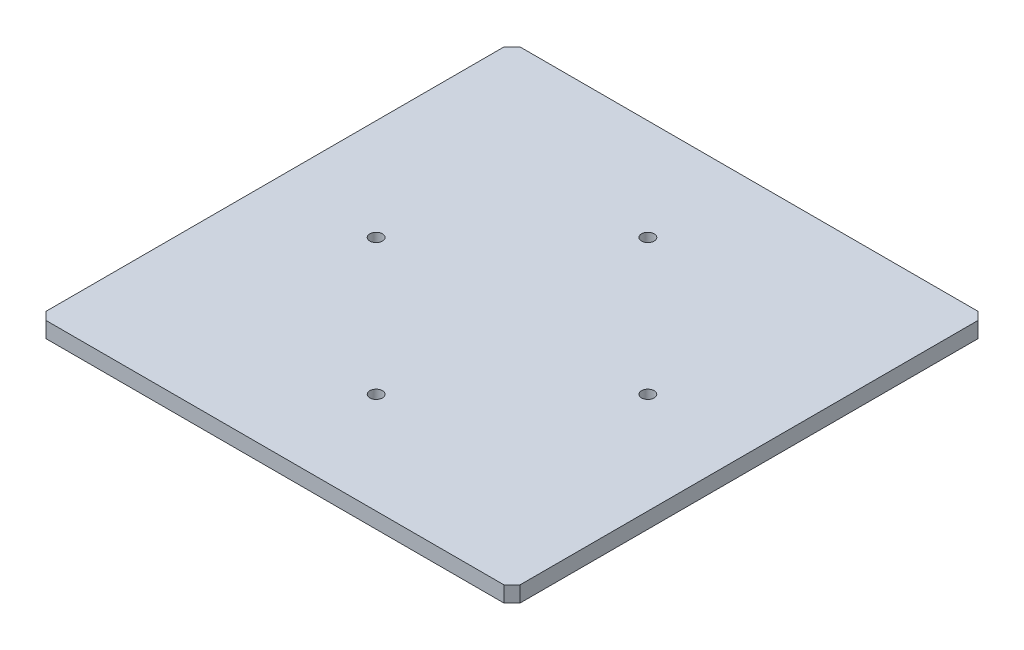
from build123d import *

# Parameters (mm, degrees)
SKETCH_1_W          = 300
SKETCH_1_H          = 300
EXTRUDE_1_DEPTH     = 10
CHAMFER_1_SIZE      = 5
SKETCH_2_R          = 4
CUT_EXTRUDE_1_DEPTH = 10


with BuildPart() as part:
    # 스케치1 → 보스-돌출1 (new body)
    with BuildSketch(Plane(origin=(0, 0, 0), x_dir=(1, 0, 0), z_dir=(0, 1, 0))):
        Rectangle(SKETCH_1_W, SKETCH_1_H)
    extrude(amount=EXTRUDE_1_DEPTH)

    # 모따기1
    chamfer_1_edges = [part.edges().sort_by_distance(p)[0] for p in [
        (150, 5, 150),
        (-150, 5, 150),
        (-150, 5, -150),
        (150, 5, -150),
    ]]
    chamfer(chamfer_1_edges, length=CHAMFER_1_SIZE)

    # 스케치2 → 컷-돌출1 (cut)
    with BuildSketch(Plane(origin=(0, 10, 0), x_dir=(1, 0, 0), z_dir=(0, 1, 0))):
        with Locations(Location((0, -86, 0), (0, 0, 270))):
            Circle(SKETCH_2_R)
        with Locations(Location((-86, 0, 0), (0, 0, 270))):
            Circle(SKETCH_2_R)
        with Locations(Location((0, 86, 0), (0, 0, 270))):
            Circle(SKETCH_2_R)
        with Locations(Location((86, 0, 0), (0, 0, 270))):
            Circle(SKETCH_2_R)
    extrude(amount=-CUT_EXTRUDE_1_DEPTH, mode=Mode.SUBTRACT)


solid = part.part
